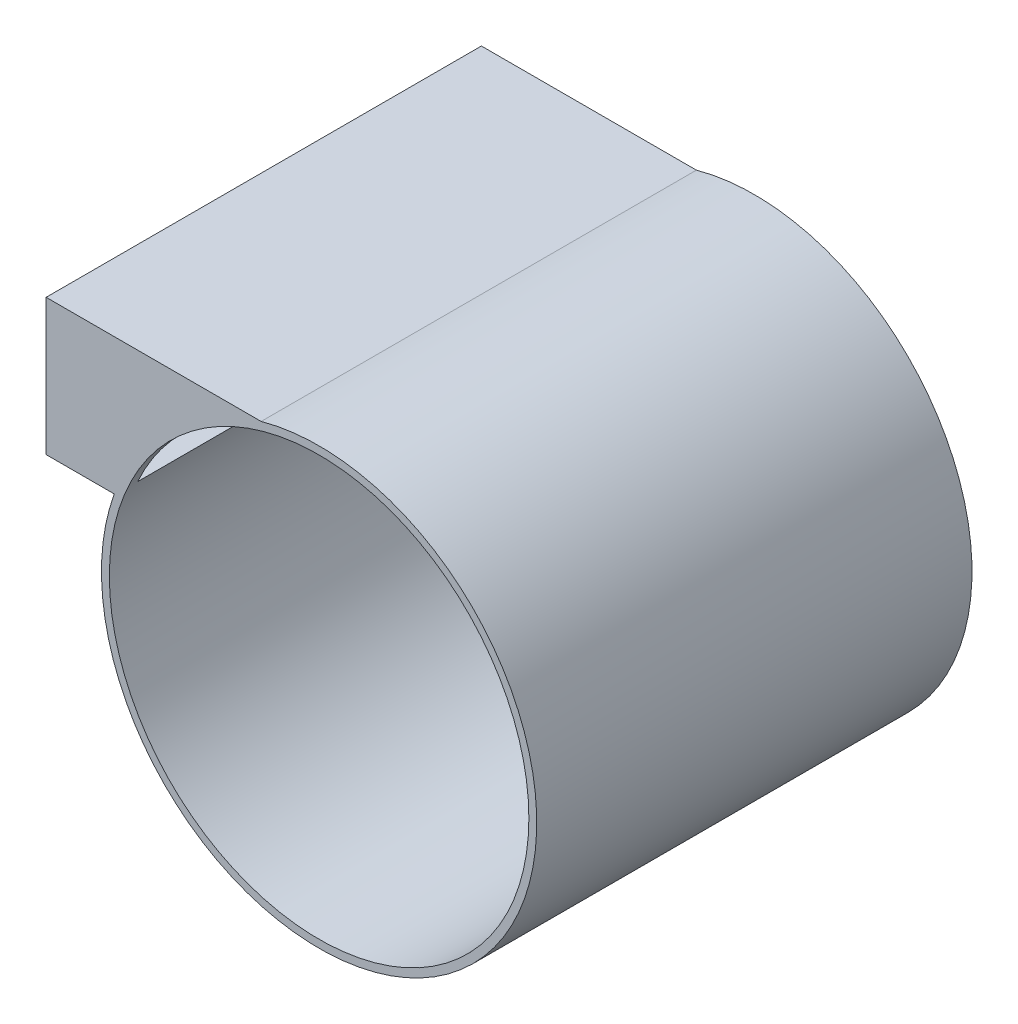
from build123d import *

# Parameters (mm, degrees)
SKETCH1_R                = 105.41
BOSS_EXTRUDE1_DEPTH      = 210.82
SKETCH2_R                = 101.6
CUT_EXTRUDE1_DEPTH       = 203.2
BOSS_EXTRUDE2_DEPTH      = 203.2
BOSS_EXTRUDE2_DEPTH_BACK = 7.62
SKETCH3_W                = 132.216629509
SKETCH3_H                = 65.995330398
SKETCH4_W                = 200.799602593
SKETCH4_H                = 54.314646603
CUT_EXTRUDE2_DEPTH       = 147.574
SKETCH5_R                = 101.6
CUT_EXTRUDE3_DEPTH       = 147.574
SKETCH6_R                = 101.6
CUT_EXTRUDE4_DEPTH       = 60.706


with BuildPart() as part:
    # Sketch1 → Boss-Extrude1 (new body)
    with BuildSketch(Plane.XY):
        Circle(SKETCH1_R)
    extrude(amount=BOSS_EXTRUDE1_DEPTH)

    # Sketch2 → Cut-Extrude1 (cut)
    with BuildSketch(Plane.XY.offset(210.82)):
        Circle(SKETCH2_R)
    extrude(amount=-CUT_EXTRUDE1_DEPTH, mode=Mode.SUBTRACT)

    # Sketch3 → Boss-Extrude2 (add, two sides: drawn at the far end of the back side and taken through both)
    with BuildSketch(Plane.XY.offset(7.62).offset(-BOSS_EXTRUDE2_DEPTH_BACK)):
        with Locations((-66.108314755, 68.602334801)):
            Rectangle(SKETCH3_W, SKETCH3_H)
    extrude(amount=BOSS_EXTRUDE2_DEPTH + BOSS_EXTRUDE2_DEPTH_BACK)

    # Sketch4 → Cut-Extrude2 (cut)
    with BuildSketch(Plane.ZY.offset(132.216629509)):
        with Locations((105.657754662, 68.844414065)):
            Rectangle(SKETCH4_W, SKETCH4_H)
    extrude(amount=-CUT_EXTRUDE2_DEPTH, mode=Mode.SUBTRACT)

    # Sketch5 → Cut-Extrude3 (cut)
    with BuildSketch(Plane.XY.offset(210.82)):
        Circle(SKETCH5_R)
    extrude(amount=-CUT_EXTRUDE3_DEPTH, mode=Mode.SUBTRACT)

    # Sketch6 → Cut-Extrude4 (cut)
    with BuildSketch(Plane.XY.offset(63.246)):
        Circle(SKETCH6_R)
    extrude(amount=-CUT_EXTRUDE4_DEPTH, mode=Mode.SUBTRACT)


solid = part.part
